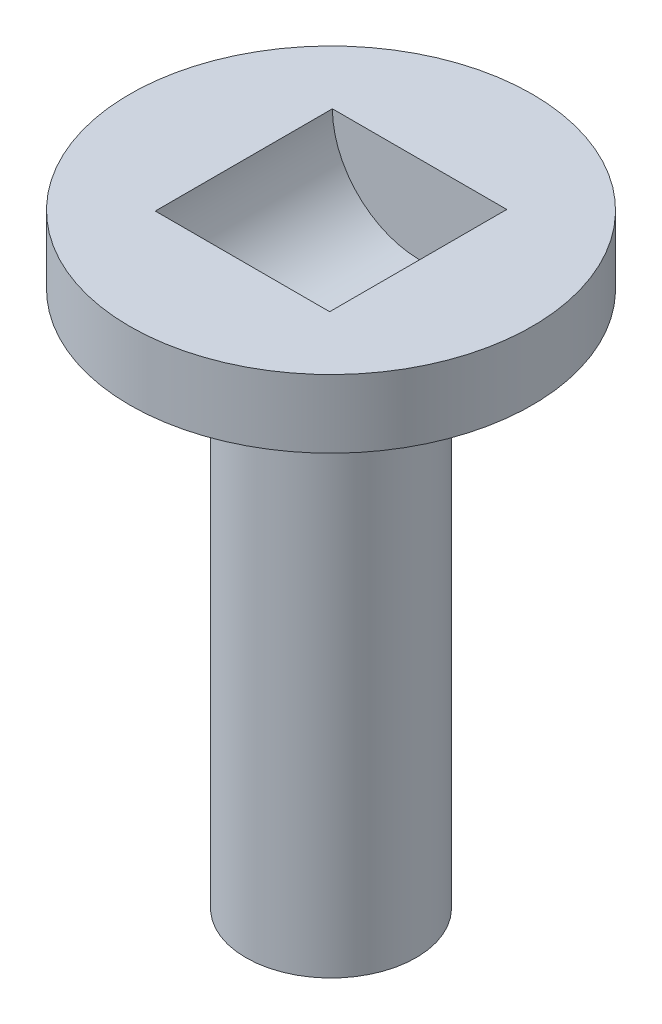
from build123d import *

# Parameters (mm, degrees)
SKETCH1_R               = 3.175
BOSS_EXTRUDE1_DEPTH     = 20
SKETCH2_R               = 0.9
CUT_EXTRUDE1_DEPTH      = 10
SKETCH4_R               = 7.5
BOSS_EXTRUDE2_DEPTH     = 2.54
SKETCH6_R               = 4.85
BOSS_EXTRUDE3_DEPTH     = 3.35
CUT_EXTRUDE3_DEPTH      = 3.3
CUT_EXTRUDE3_DEPTH_BACK = 3.302
SKETCH5_R               = 3.25


with BuildPart() as part:
    # Sketch1 → Boss-Extrude1 (new body)
    with BuildSketch(Plane(origin=(0, 0, 0), x_dir=(1, 0, 0), z_dir=(0, 1, 0))):
        with Locations(Location((0, 0, 0), (0, 0, 270))):
            Circle(SKETCH1_R)
    extrude(amount=BOSS_EXTRUDE1_DEPTH)

    # Sketch2 → Cut-Extrude1 (cut)
    with BuildSketch(Plane.XZ):
        with Locations(Location((0, 0, 0), (0, 0, 270))):
            Circle(SKETCH2_R)
    extrude(amount=-CUT_EXTRUDE1_DEPTH, mode=Mode.SUBTRACT)

    # Sketch4 → Boss-Extrude2 (add)
    with BuildSketch(Plane(origin=(0, 20, 0), x_dir=(1, 0, 0), z_dir=(0, 1, 0))):
        with Locations(Location((0, 0, 0), (0, 0, 270))):
            Circle(SKETCH4_R)
    extrude(amount=BOSS_EXTRUDE2_DEPTH)

    # Sketch6 → Boss-Extrude3 (add)
    with BuildSketch(Plane(origin=(0, 22.54, 0), x_dir=(1, 0, 0), z_dir=(0, 1, 0))):
        with Locations(Location((0, 0, 0), (0, 0, 270))):
            Circle(SKETCH6_R)
    extrude(amount=-BOSS_EXTRUDE3_DEPTH)

    # Sketch5 → Cut-Extrude3 (cut, two sides: drawn at the far end of the back side and taken through both)
    with BuildSketch(Plane.XY.offset(-CUT_EXTRUDE3_DEPTH_BACK)):
        with Locations((0, 22.54)):
            Circle(SKETCH5_R)
    extrude(amount=CUT_EXTRUDE3_DEPTH + CUT_EXTRUDE3_DEPTH_BACK, mode=Mode.SUBTRACT)


solid = part.part
